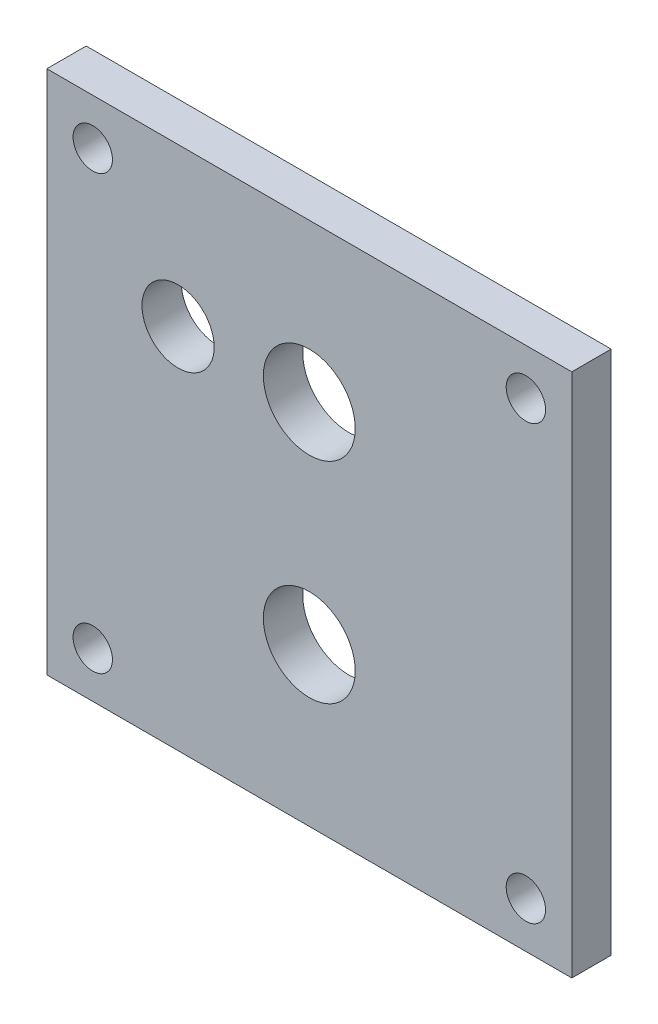
from build123d import *

# Parameters (mm, degrees)
SKETCH1_W           = 127
SKETCH1_H           = 127
BOSS_EXTRUDE1_DEPTH = 9.525
SKETCH2_R           = 11.1125
SKETCH2_R_2         = 8.73125
CUT_EXTRUDE1_DEPTH  = 9.525
SKETCH3_R           = 4.7625
CUT_EXTRUDE2_DEPTH  = 9.525


with BuildPart() as part:
    # Sketch1 → Boss-Extrude1 (new body)
    with BuildSketch(Plane.XY):
        Rectangle(SKETCH1_W, SKETCH1_H)
    extrude(amount=BOSS_EXTRUDE1_DEPTH)

    # Sketch2 → Cut-Extrude1 (cut)
    with BuildSketch(Plane(origin=(0, 0, 0), x_dir=(-1, 0, 0), z_dir=(0, 0, -1))):
        with Locations((0, 25.4)):
            Circle(SKETCH2_R)
        with Locations((31.75, 25.4)):
            Circle(SKETCH2_R_2)
        with Locations((0, -25.4)):
            Circle(SKETCH2_R)
    extrude(amount=-CUT_EXTRUDE1_DEPTH, mode=Mode.SUBTRACT)

    # Sketch3 → Cut-Extrude2 (cut)
    with BuildSketch(Plane(origin=(0, 0, 0), x_dir=(-1, 0, 0), z_dir=(0, 0, -1))):
        with Locations((52.3875, 52.3875)):
            Circle(SKETCH3_R)
        with Locations((52.3875, -52.3875)):
            Circle(SKETCH3_R)
        with Locations((-52.3875, 52.3875)):
            Circle(SKETCH3_R)
        with Locations((-52.3875, -52.3875)):
            Circle(SKETCH3_R)
    extrude(amount=-CUT_EXTRUDE2_DEPTH, mode=Mode.SUBTRACT)


solid = part.part
